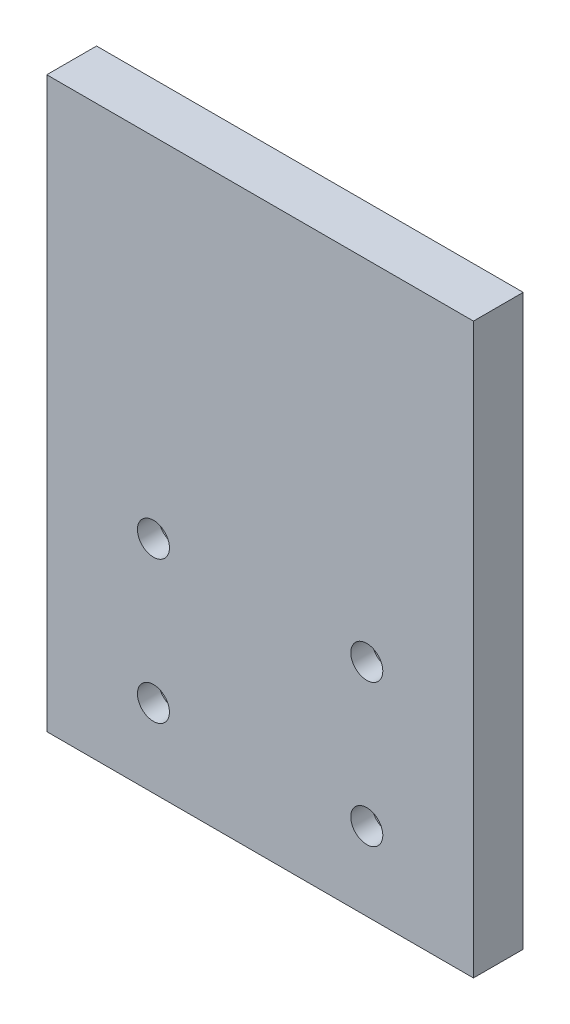
from build123d import *

# Parameters (mm, degrees)
SKETCH_1_W                   = 60
SKETCH_1_H                   = 80
EXTRUDE_1_DEPTH              = 7
HOLE_WIZARD_M4_1_D           = 4.5
HOLE_WIZARD_M4_1_CBORE_D     = 8
HOLE_WIZARD_M4_1_CBORE_DEPTH = 4


with BuildPart() as part:
    # 스케치1 → 보스-돌출1 (new body)
    with BuildSketch(Plane.XY):
        Rectangle(SKETCH_1_W, SKETCH_1_H)
    extrude(amount=EXTRUDE_1_DEPTH)

    # M4 소켓 머리 캡 나사용 카운터보어1 (through all)
    with Locations(Plane(origin=(0, 0, 0), x_dir=(-1, 0, 0), z_dir=(0, 0, -1))):
        with Locations((-15, -29), (15, -29), (-15, -9), (15, -9)):
            CounterBoreHole(HOLE_WIZARD_M4_1_D / 2, HOLE_WIZARD_M4_1_CBORE_D / 2, HOLE_WIZARD_M4_1_CBORE_DEPTH)


solid = part.part
